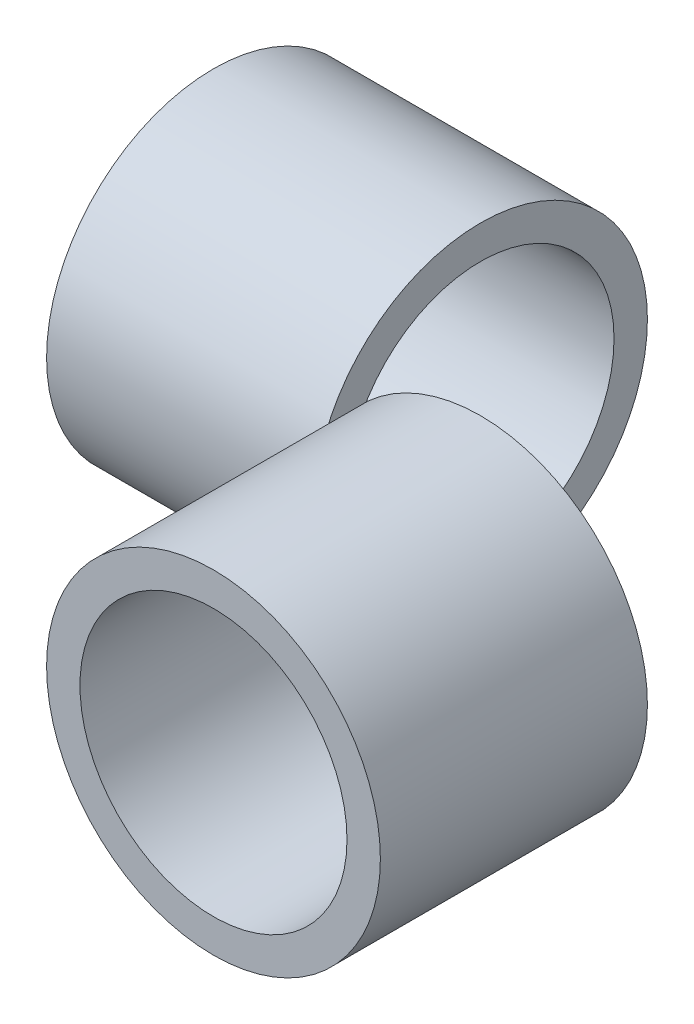
from build123d import *

# Parameters (mm, degrees)
SKETCH1_R           = 15.875
SKETCH1_R_2         = 12.7
BOSS_EXTRUDE1_DEPTH = 25.4
SKETCH5_R           = 15.875
SKETCH5_R_2         = 12.7
BOSS_EXTRUDE2_DEPTH = 25.4


with BuildPart() as part:
    # Sketch1 → Boss-Extrude1 (new body)
    with BuildSketch(Plane.XY):
        Circle(SKETCH1_R)
        Circle(SKETCH1_R_2, mode=Mode.SUBTRACT)
    extrude(amount=BOSS_EXTRUDE1_DEPTH)


with BuildPart() as body_2:
    # Sketch5 → Boss-Extrude2 (new body)
    with BuildSketch(Plane(origin=(-15.875, 0, 0), x_dir=(0, 0, -1), z_dir=(1, 0, 0))):
        with Locations((15.875, 0)):
            Circle(SKETCH5_R)
        with Locations((15.875, 0)):
            Circle(SKETCH5_R_2, mode=Mode.SUBTRACT)
    extrude(amount=-BOSS_EXTRUDE2_DEPTH)


solid = Compound([part.part, body_2.part])
